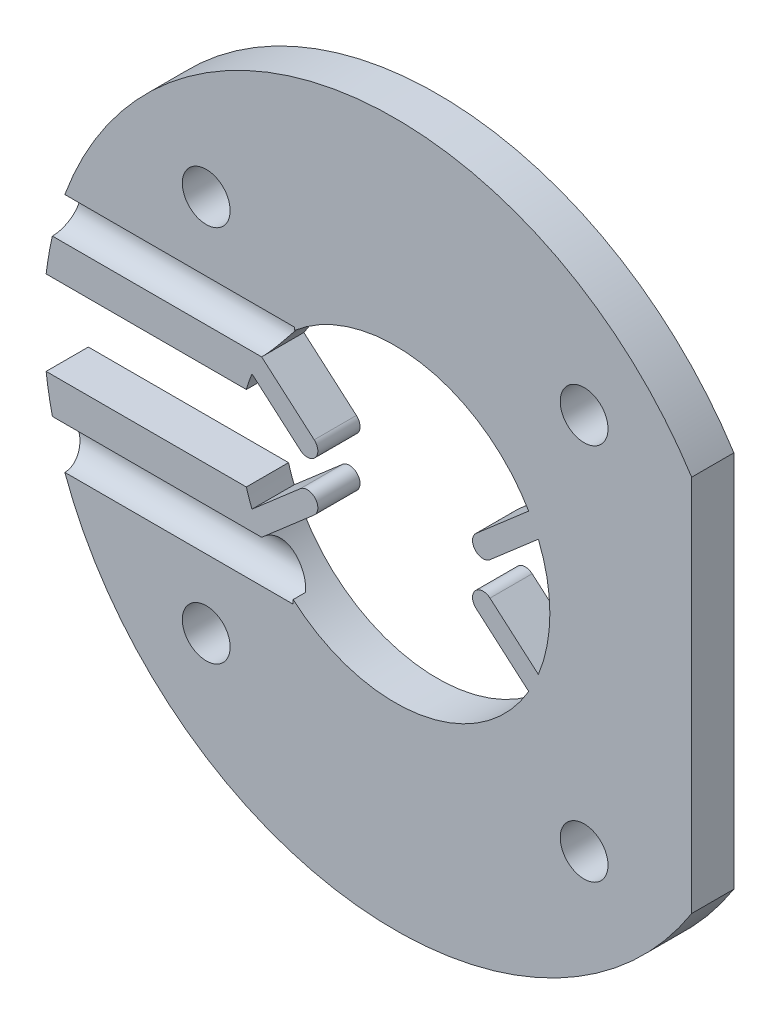
from build123d import *

# Parameters (mm, degrees)
ESQUISSE1_R             = 25
ESQUISSE1_R_2           = 1.7
BOSS_EXTRU_1_DEPTH      = 3
ESQUISSE6_R             = 11
ENL_V_MAT_EXTRU_2_DEPTH = 36.482389998
BOSS_EXTRU_6_DEPTH      = 3
ESQUISSE11_W            = 18.64617436
ESQUISSE11_H            = 6
ENL_V_MAT_EXTRU_3_DEPTH = 36.482389998
ESQUISSE12_W            = 17.120822442
ESQUISSE12_H            = 1.5
ESQUISSE13_W            = 17.212222589
ESQUISSE13_H            = 1.5
ESQUISSE14_W            = 6.427132246
ESQUISSE14_H            = 29.186840833
ENL_V_MAT_EXTRU_4_DEPTH = 36.482390148


with BuildPart() as part:
    # Esquisse1 → Boss.-Extru.1 (new body)
    with BuildSketch(Plane.XY):
        Circle(ESQUISSE1_R)
        with Locations((-13.435028843, 13.435028843)):
            Circle(ESQUISSE1_R_2, mode=Mode.SUBTRACT)
        with Locations((13.435028843, 13.435028843)):
            Circle(ESQUISSE1_R_2, mode=Mode.SUBTRACT)
        with Locations((13.435028843, -13.435028843)):
            Circle(ESQUISSE1_R_2, mode=Mode.SUBTRACT)
        with Locations((-13.435028843, -13.435028843)):
            Circle(ESQUISSE1_R_2, mode=Mode.SUBTRACT)
    extrude(amount=BOSS_EXTRU_1_DEPTH)

    # Esquisse6 → Enlèv. mat.-Extru.2 (cut, through all)
    with BuildSketch(Plane(origin=(0, 0, 0), x_dir=(-1, 0, 0), z_dir=(0, 0, -1))):
        Circle(ESQUISSE6_R)
    extrude(amount=-ENL_V_MAT_EXTRU_2_DEPTH, mode=Mode.SUBTRACT)

    # Esquisse10 → Boss.-Extru.6 (add)
    with BuildSketch(Plane.XY.offset(3)):
        with BuildLine():
            Line((-5.758802096, -2.316766812), (-9.508802096, -5.566766812))
            ThreePointArc((-9.508802096, -5.566766812), (-10.566766812, -5.491197904), (-10.491197904, -4.433233188))
            Line((-10.491197904, -4.433233188), (-6.741197904, -1.183233188))
            ThreePointArc((-6.741197904, -1.183233188), (-5.683233188, -1.258802096), (-5.758802096, -2.316766812))
        make_face()
        with BuildLine():
            Line((-6.741197904, 1.183233188), (-10.491197904, 4.433233188))
            ThreePointArc((-10.491197904, 4.433233188), (-10.566766812, 5.491197904), (-9.508802096, 5.566766812))
            Line((-9.508802096, 5.566766812), (-5.758802096, 2.316766812))
            ThreePointArc((-5.758802096, 2.316766812), (-5.683233188, 1.258802096), (-6.741197904, 1.183233188))
        make_face()
        with BuildLine():
            Line((9.508802096, -5.566766812), (5.758802096, -2.316766812))
            ThreePointArc((5.758802096, -2.316766812), (5.683233188, -1.258802096), (6.741197904, -1.183233188))
            Line((6.741197904, -1.183233188), (10.491197904, -4.433233188))
            ThreePointArc((10.491197904, -4.433233188), (10.566766812, -5.491197904), (9.508802096, -5.566766812))
        make_face()
        with BuildLine():
            Line((10.491197904, 4.433233188), (6.741197904, 1.183233188))
            ThreePointArc((6.741197904, 1.183233188), (5.683233188, 1.258802096), (5.758802096, 2.316766812))
            Line((5.758802096, 2.316766812), (9.508802096, 5.566766812))
            ThreePointArc((9.508802096, 5.566766812), (10.566766812, 5.491197904), (10.491197904, 4.433233188))
        make_face()
    extrude(amount=-BOSS_EXTRU_6_DEPTH)

    # Esquisse11 → Enlèv. mat.-Extru.3 (cut, through all)
    with BuildSketch(Plane.XY.offset(3)):
        with Locations((-19.368578738, 0)):
            Rectangle(ESQUISSE11_W, ESQUISSE11_H)
    extrude(amount=-ENL_V_MAT_EXTRU_3_DEPTH, mode=Mode.SUBTRACT)

    # Esquisse12 → Enlèvement de matière-Révolution1 (revolve, cut)
    with BuildSketch(Plane.XY.offset(3)):
        with Locations((-15.814736021, -6.304475395)):
            Rectangle(ESQUISSE12_W, ESQUISSE12_H)
    revolve(axis=Axis((-24.375147242, -7.054475395, 3), (1, 0, 0)), mode=Mode.SUBTRACT)

    # Esquisse13 → Enlèvement de matière-Révolution2 (revolve, cut)
    with BuildSketch(Plane.XY.offset(3)):
        with Locations((-15.769035948, 6.304475395)):
            Rectangle(ESQUISSE13_W, ESQUISSE13_H)
    revolve(axis=Axis((-24.375147242, 7.054475395, 3), (1, 0, 0)), mode=Mode.SUBTRACT)

    # Esquisse14 → Enlèv. mat.-Extru.4 (cut, through all)
    with BuildSketch(Plane.XY.offset(3)):
        with Locations((24.296734765, 1.158391573)):
            Rectangle(ESQUISSE14_W, ESQUISSE14_H)
    extrude(amount=-ENL_V_MAT_EXTRU_4_DEPTH, mode=Mode.SUBTRACT)


solid = part.part
